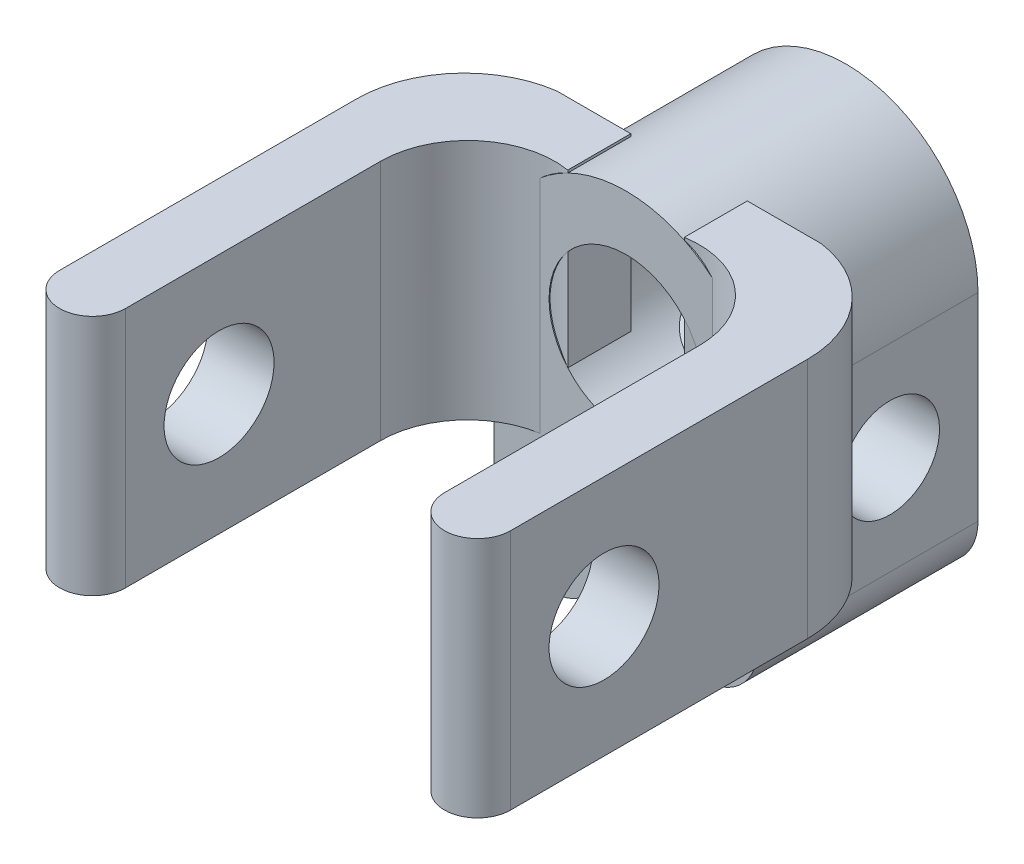
from build123d import *

# Parameters (mm, degrees)
BOSS_EXTRUDE1_DEPTH      = 20
BOSS_EXTRUDE2_DEPTH      = 11
BOSS_EXTRUDE2_DEPTH_BACK = 11
CUT_EXTRUDE1_DEPTH       = 63.171134781
CUT_EXTRUDE1_DEPTH_BACK  = 63.171134781
SKETCH3_R                = 5
SKETCH3_R_2              = 4.5


with BuildPart() as part:
    # Sketch1 → Boss-Extrude1 (new body)
    with BuildSketch(Plane.XY):
        with BuildLine():
            Line((-12, -18), (-12, 0))
            ThreePointArc((-12, 0), (0, 12), (12, 0))
            Line((12, 0), (12, -18))
            ThreePointArc((12, -18), (7, -23), (2, -18))
            Line((2, -18), (2, -6.708203932))
            ThreePointArc((2, -6.708203932), (0, 7), (-2, -6.708203932))
            Line((-2, -6.708203932), (-2, -18))
            ThreePointArc((-2, -18), (-7, -23), (-12, -18))
        make_face()
    extrude(amount=BOSS_EXTRUDE1_DEPTH)

    # Sketch2 → Boss-Extrude2 (add, two sides: drawn at the far end of the back side and taken through both)
    with BuildSketch(Plane(origin=(0, 0, 0), x_dir=(1, 0, 0), z_dir=(0, 1, 0)).offset(-BOSS_EXTRUDE2_DEPTH_BACK)):
        with BuildLine():
            Line((-20.5, -51), (-20.5, -24))
            ThreePointArc((-20.5, -24), (-18.075652903, -17.540680891), (-12, -14.271628429))
            Line((-12, -14.271628429), (-5.296851039, -14.271628429))
            Line((-5.296851039, -14.271628429), (-5.296851039, -20))
            ThreePointArc((-5.296851039, -20), (-11.707630257, -21.787067507), (-14.5, -27.828124672))
            Line((-14.5, -27.828124672), (-14.5, -51))
            ThreePointArc((-14.5, -51), (-17.5, -54), (-20.5, -51))
        make_face()
        with BuildLine():
            Line((14.5, -51), (14.5, -27.828124672))
            ThreePointArc((14.5, -27.828124672), (11.707630257, -21.787067507), (5.296851039, -20))
            Line((5.296851039, -20), (5.296851039, -14.271628429))
            Line((5.296851039, -14.271628429), (12, -14.271628429))
            ThreePointArc((12, -14.271628429), (18.075652903, -17.540680891), (20.5, -24))
            Line((20.5, -24), (20.5, -51))
            ThreePointArc((20.5, -51), (17.5, -54), (14.5, -51))
        make_face()
    extrude(amount=BOSS_EXTRUDE2_DEPTH + BOSS_EXTRUDE2_DEPTH_BACK)

    # Sketch3 → Cut-Extrude1 (cut, two sides: drawn at the far end of the back side and taken through both)
    with BuildSketch(Plane(origin=(0, 0, 0), x_dir=(0, 0, -1), z_dir=(1, 0, 0)).offset(-CUT_EXTRUDE1_DEPTH_BACK)):
        with Locations((-42.5, 0)):
            Circle(SKETCH3_R)
        with Locations((-8, -9)):
            Circle(SKETCH3_R_2)
    extrude(amount=CUT_EXTRUDE1_DEPTH + CUT_EXTRUDE1_DEPTH_BACK, mode=Mode.SUBTRACT)


solid = part.part
